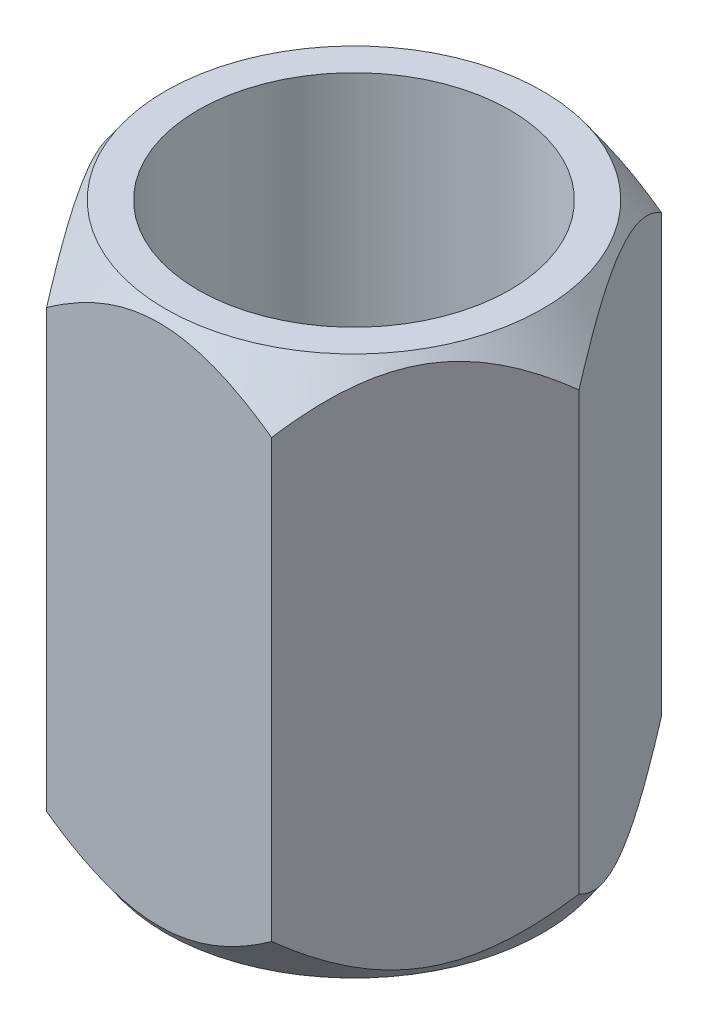
from build123d import *

# Parameters (mm, degrees)
SKETCH_1_R      = 6
EXTRUDE_1_DEPTH = 10.4


with BuildPart() as part:
    # 草图1 → 凸台-拉伸1 (new, symmetric)
    with BuildSketch(Plane(origin=(0, 0, 0), x_dir=(1, 0, 0), z_dir=(0, 1, 0))):
        Polygon((4.330127019, 7.5), (-4.330127019, 7.5), (-8.660254038, 0), (-4.330127019, -7.5), (4.330127019, -7.5), (8.660254038, 0), align=None)
        with Locations(Location((0, 0, 0), (0, 0, 270))):
            Circle(SKETCH_1_R, mode=Mode.SUBTRACT)
    extrude(amount=EXTRUDE_1_DEPTH, both=True)

    # 草图3 → 切除-旋转1 (revolve, cut)
    with BuildSketch(Plane.XY, mode=Mode.PRIVATE) as cut_revolve_1_sk:
        Polygon((7.260254038, 10.4), (8.660254038, 8.4), (8.660254038, 10.4), align=None)
        Polygon((8.660254038, -10.4), (7.260254038, -10.4), (8.660254038, -8.4), align=None)
    revolve(cut_revolve_1_sk.sketch.rotate(Axis((0, 21.443940686, 0), (0, -1, 0)), 300.000000037), axis=Axis((0, 21.443940686, 0), (0, -1, 0)), mode=Mode.SUBTRACT)


solid = part.part
